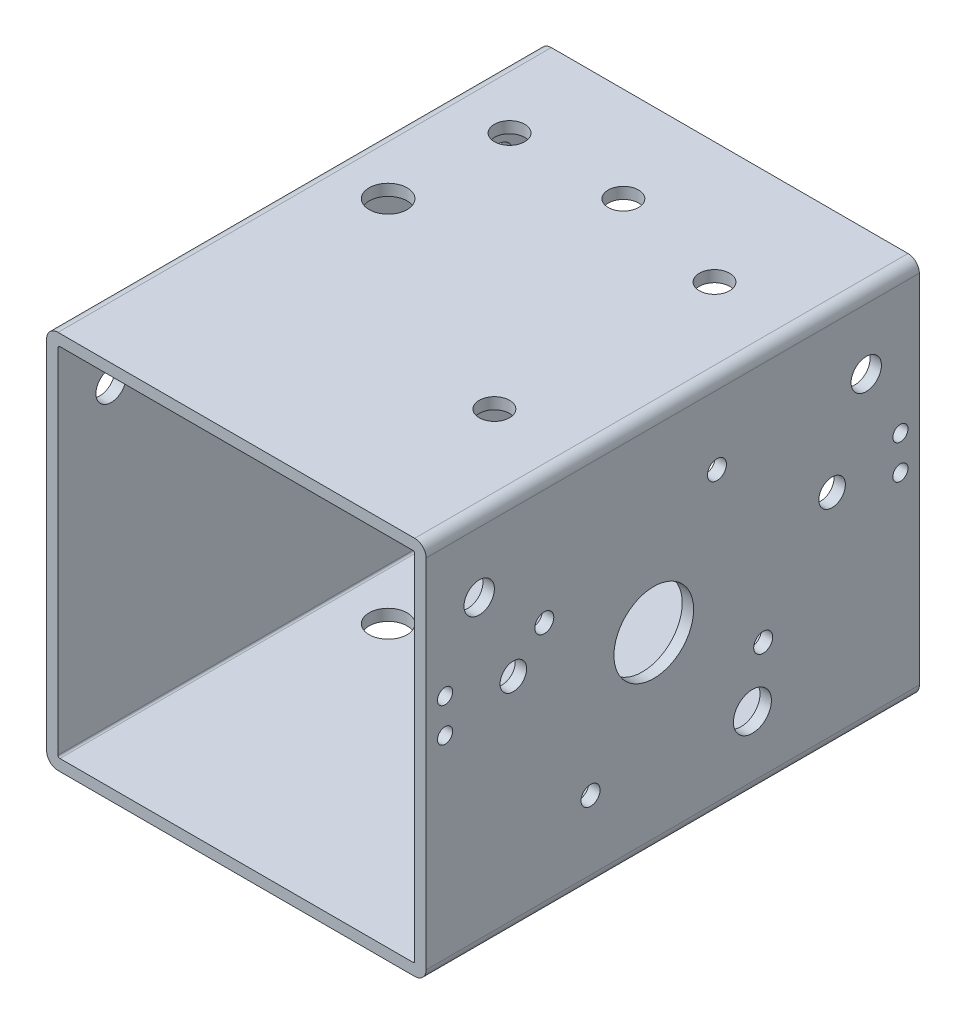
from build123d import *

# Parameters (mm, degrees)
SKETCH1_W                      = 100
SKETCH1_H                      = 100
SKETCH1_W_2                    = 94
SKETCH1_H_2                    = 94
EXTRUDE_THIN1_DEPTH            = 130
FILLET1_R                      = 0.5
FILLET2_R                      = 3
F_8_0_8_DIAMETER_HOLE2_D       = 8
F_8_0_8_DIAMETER_HOLE3_D       = 8
F_10_0_10_DIAMETER_HOLE1_D     = 10
F_10_0_10_DIAMETER_HOLE2_D     = 10
M8X1_25_TAPPED_HOLE1_D         = 6.8
M8X1_25_TAPPED_HOLE1_DEPTH     = 3
M8X1_25_TAPPED_HOLE2_D         = 6.8
M8X1_25_TAPPED_HOLE2_DEPTH     = 3
F_21_0_21_DIAMETER_HOLE1_D     = 21
F_21_0_21_DIAMETER_HOLE1_DEPTH = 3
F_5_0_5_DIAMETER_HOLE1_D       = 5
F_5_0_5_DIAMETER_HOLE1_DEPTH   = 3
F_8_0_8_DIAMETER_HOLE4_D       = 8
F_8_0_8_DIAMETER_HOLE4_DEPTH   = 3
CUT_EXTRUDE1_REACH             = 173.464
SKETCH31_R                     = 2
SKETCH31_R_2                   = 3.5
F_8_0_8_DIAMETER_HOLE5_D       = 8
F_8_0_8_DIAMETER_HOLE5_DEPTH   = 3


with BuildPart() as part:
    # Sketch1 → Extrude-Thin1 (new body)
    with BuildSketch(Plane.XY):
        Rectangle(SKETCH1_W, SKETCH1_H)
        Rectangle(SKETCH1_W_2, SKETCH1_H_2, mode=Mode.SUBTRACT)
    extrude(amount=EXTRUDE_THIN1_DEPTH)

    # Fillet1
    fillet1_edges = [part.edges().sort_by_distance(p)[0] for p in [
        (47, -47, 65),
        (47, 47, 65),
        (-47, 47, 65),
        (-47, -47, 65),
    ]]
    fillet(fillet1_edges, radius=FILLET1_R)

    # Fillet2
    fillet2_edges = [part.edges().sort_by_distance(p)[0] for p in [
        (50, -50, 65),
        (-50, -50, 65),
        (-50, 50, 65),
        (50, 50, 65),
    ]]
    fillet(fillet2_edges, radius=FILLET2_R)

    # Ø8.0 (8) Diameter Hole2 (through all)
    with Locations(Plane(origin=(0, 50, 0), x_dir=(1, 0, 0), z_dir=(0, 1, 0))):
        with Locations((28, -32), (28, -90)):
            Hole(F_8_0_8_DIAMETER_HOLE2_D / 2)

    # Ø8.0 (8) Diameter Hole3 (through all)
    with Locations(Plane(origin=(50, 0, 0), x_dir=(0, 0, -1), z_dir=(1, 0, 0))):
        with Locations((-14, 31), (-116, 31)):
            Hole(F_8_0_8_DIAMETER_HOLE3_D / 2)

    # Ø10.0 (10) Diameter Hole1 (through all)
    with Locations(Plane(origin=(0, 50, 0), x_dir=(1, 0, 0), z_dir=(0, 1, 0))):
        with Locations((-34, -56)):
            Hole(F_10_0_10_DIAMETER_HOLE1_D / 2)

    # Ø10.0 (10) Diameter Hole2 (through all)
    with Locations(Plane(origin=(50, 0, 0), x_dir=(0, 0, -1), z_dir=(1, 0, 0))):
        with Locations((-44, -31)):
            Hole(F_10_0_10_DIAMETER_HOLE2_D / 2)

    # M8x1.25 Tapped Hole1
    with Locations(Plane.ZY.offset(50)):
        with Locations((56, -15), (56, 35)):
            Hole(M8X1_25_TAPPED_HOLE1_D / 2, depth=M8X1_25_TAPPED_HOLE1_DEPTH)

    # M8x1.25 Tapped Hole2
    with Locations(Plane(origin=(0, -50, 0), x_dir=(-1, 0, 0), z_dir=(0, -1, 0))):
        with Locations((20, -44), (-35, -44)):
            Hole(M8X1_25_TAPPED_HOLE2_D / 2, depth=M8X1_25_TAPPED_HOLE2_DEPTH)

    # Ø21.0 (21) Diameter Hole1
    with Locations(Plane(origin=(50, 0, 0), x_dir=(0, 0, -1), z_dir=(1, 0, 0))):
        with Locations((-70, 0)):
            Hole(F_21_0_21_DIAMETER_HOLE1_D / 2, depth=F_21_0_21_DIAMETER_HOLE1_DEPTH)

    # Ø5.0 (5) Diameter Hole1
    with Locations(Plane(origin=(50, 0, 0), x_dir=(0, 0, -1), z_dir=(1, 0, 0))):
        with Locations((-41.157258279, -16.652364697), (-53.347635303, 28.842741721), (-98.842741721, 16.652364697), (-86.652364697, -28.842741721)):
            Hole(F_5_0_5_DIAMETER_HOLE1_D / 2, depth=F_5_0_5_DIAMETER_HOLE1_DEPTH)

    # Ø8.0 (8) Diameter Hole4
    with Locations(Plane(origin=(0, 50, 0), x_dir=(1, 0, 0), z_dir=(0, 1, 0))):
        with Locations((-3, -25)):
            Hole(F_8_0_8_DIAMETER_HOLE4_D / 2, depth=F_8_0_8_DIAMETER_HOLE4_DEPTH)

    # Sketch31 → Cut-Extrude1 (cut, up to next)
    with BuildSketch(Plane(origin=(50, 0, 0), x_dir=(0, 0, -1), z_dir=(1, 0, 0)), mode=Mode.PRIVATE) as cut_extrude1_sk1:
        with Locations(Location((-5, 4, 0), (0, 0, 90))):
            Circle(SKETCH31_R)
    cut_extrude1_tool1 = extrude(cut_extrude1_sk1.sketch, amount=-CUT_EXTRUDE1_REACH, mode=Mode.PRIVATE) & part.part
    # Sketch31 → Cut-Extrude1 (cut, up to next)
    with BuildSketch(Plane(origin=(50, 0, 0), x_dir=(0, 0, -1), z_dir=(1, 0, 0)), mode=Mode.PRIVATE) as cut_extrude1_sk2:
        with Locations(Location((-5, 13, 0), (0, 0, 90))):
            Circle(SKETCH31_R)
    cut_extrude1_tool2 = extrude(cut_extrude1_sk2.sketch, amount=-CUT_EXTRUDE1_REACH, mode=Mode.PRIVATE) & part.part
    # Sketch31 → Cut-Extrude1 (cut, up to next)
    with BuildSketch(Plane(origin=(50, 0, 0), x_dir=(0, 0, -1), z_dir=(1, 0, 0)), mode=Mode.PRIVATE) as cut_extrude1_sk3:
        with Locations(Location((-125, 13, 0), (0, 0, 90))):
            Circle(SKETCH31_R)
    cut_extrude1_tool3 = extrude(cut_extrude1_sk3.sketch, amount=-CUT_EXTRUDE1_REACH, mode=Mode.PRIVATE) & part.part
    # Sketch31 → Cut-Extrude1 (cut, up to next)
    with BuildSketch(Plane(origin=(50, 0, 0), x_dir=(0, 0, -1), z_dir=(1, 0, 0)), mode=Mode.PRIVATE) as cut_extrude1_sk4:
        with Locations(Location((-125, 4, 0), (0, 0, 90))):
            Circle(SKETCH31_R)
    cut_extrude1_tool4 = extrude(cut_extrude1_sk4.sketch, amount=-CUT_EXTRUDE1_REACH, mode=Mode.PRIVATE) & part.part
    # Sketch31 → Cut-Extrude1 (cut, up to next)
    with BuildSketch(Plane(origin=(50, 0, 0), x_dir=(0, 0, -1), z_dir=(1, 0, 0)), mode=Mode.PRIVATE) as cut_extrude1_sk5:
        with Locations(Location((-23, 8.5, 0), (0, 0, 90))):
            Circle(SKETCH31_R_2)
    cut_extrude1_tool5 = extrude(cut_extrude1_sk5.sketch, amount=-CUT_EXTRUDE1_REACH, mode=Mode.PRIVATE) & part.part
    # Sketch31 → Cut-Extrude1 (cut, up to next)
    with BuildSketch(Plane(origin=(50, 0, 0), x_dir=(0, 0, -1), z_dir=(1, 0, 0)), mode=Mode.PRIVATE) as cut_extrude1_sk6:
        with Locations(Location((-107, 8.5, 0), (0, 0, 90))):
            Circle(SKETCH31_R_2)
    cut_extrude1_tool6 = extrude(cut_extrude1_sk6.sketch, amount=-CUT_EXTRUDE1_REACH, mode=Mode.PRIVATE) & part.part
    add(cut_extrude1_tool1.solids().sort_by_distance((50, 4, 5))[0], mode=Mode.SUBTRACT)
    add(cut_extrude1_tool2.solids().sort_by_distance((50, 13, 5))[0], mode=Mode.SUBTRACT)
    add(cut_extrude1_tool3.solids().sort_by_distance((50, 13, 125))[0], mode=Mode.SUBTRACT)
    add(cut_extrude1_tool4.solids().sort_by_distance((50, 4, 125))[0], mode=Mode.SUBTRACT)
    add(cut_extrude1_tool5.solids().sort_by_distance((50, 8.5, 23))[0], mode=Mode.SUBTRACT)
    add(cut_extrude1_tool6.solids().sort_by_distance((50, 8.5, 107))[0], mode=Mode.SUBTRACT)

    # Ø8.0 (8) Diameter Hole5
    with Locations(Plane(origin=(0, 50, 0), x_dir=(1, 0, 0), z_dir=(0, 1, 0))):
        with Locations((-33, -25)):
            Hole(F_8_0_8_DIAMETER_HOLE5_D / 2, depth=F_8_0_8_DIAMETER_HOLE5_DEPTH)


solid = part.part
